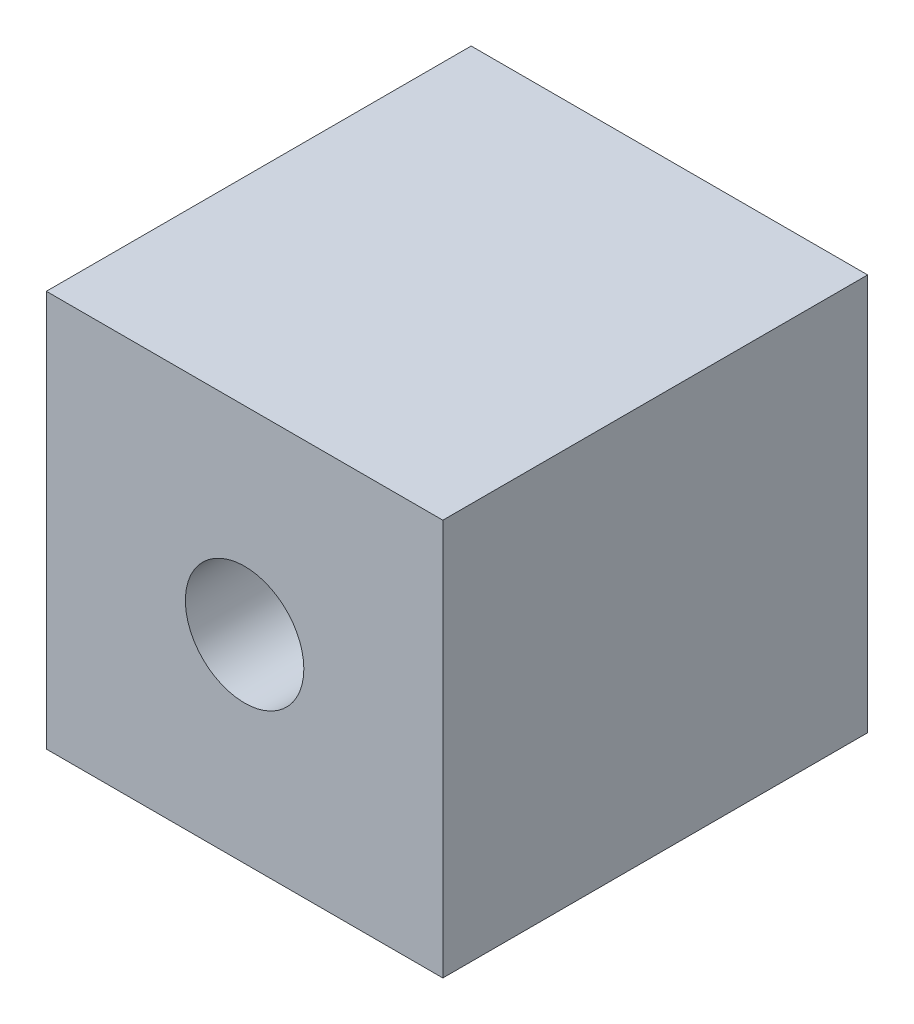
from build123d import *

# Parameters (mm, degrees)
SKETCH1_W          = 17.78
SKETCH1_H          = 17.78
EXTRUDE1_DEPTH     = 19.05
SKETCH2_R          = 2.65684
CUT_EXTRUDE1_DEPTH = 13.99999994


with BuildPart() as part:
    # Sketch1 → Extrude1 (new body)
    with BuildSketch(Plane.XY):
        with Locations((8.89, 8.89)):
            Rectangle(SKETCH1_W, SKETCH1_H)
    extrude(amount=-EXTRUDE1_DEPTH)

    # Sketch2 → Cut-Extrude1 (cut)
    with BuildSketch(Plane.XY):
        with Locations((8.89, 8.89)):
            Circle(SKETCH2_R)
    extrude(amount=-CUT_EXTRUDE1_DEPTH, mode=Mode.SUBTRACT)


solid = part.part
